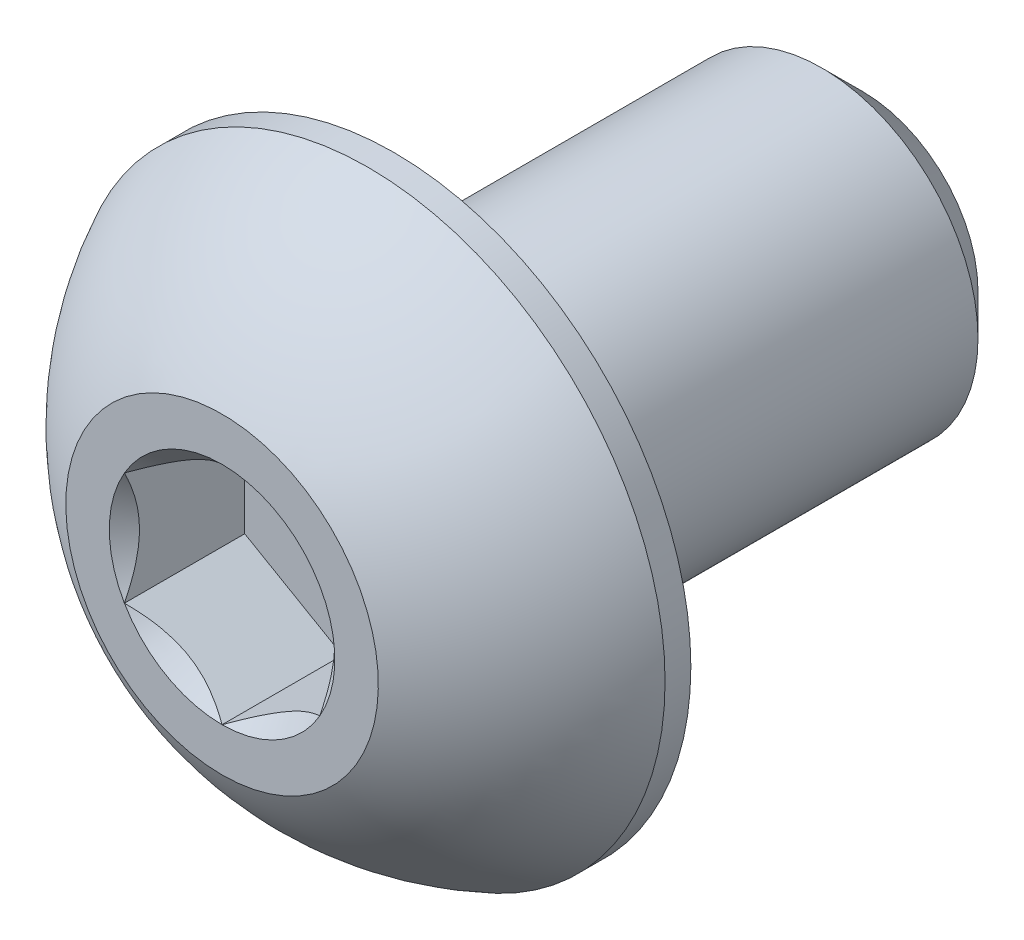
from build123d import *

# Parameters (mm, degrees)
CUT_EXTRUDE2_DEPTH = 1.54


with BuildPart() as part:
    # Sketch10 → Revolve3 (revolve)
    with BuildSketch(Plane(origin=(0, 0, 0), x_dir=(0, 0, -1), z_dir=(1, 0, 0))):
        Polygon((7.675, 2), (8.2, 1.475), (8.2, 0), (2.2, 0), (2.2, 2), align=None)
    revolve(axis=Axis((0, 0, 0), (0, 0, -1)))

    # Sketch7 → Revolve2 (revolve)
    with BuildSketch(Plane(origin=(0, 0, 0), x_dir=(0, 0, -1), z_dir=(1, 0, 0))):
        with BuildLine():
            Line((1.87, 3.8), (2.2, 3.8))
            Line((2.2, 3.8), (2.2, 0))
            Line((2.2, 0), (0, 0))
            Line((0, 0), (0, 2))
            ThreePointArc((0, 2), (0.793500147, 3.047002626), (1.87, 3.8))
        make_face()
    revolve(axis=Axis((0, 0, 0), (0, 0, -1)))

    # Sketch5 → Cut-Extrude2 (cut)
    with BuildSketch(Plane.XY):
        Polygon((1.25, -0.721687836), (1.25, 0.721687836), (0, 1.443375673), (-1.25, 0.721687836), (-1.25, -0.721687836), (0, -1.443375673), align=None)
    extrude(amount=-CUT_EXTRUDE2_DEPTH, mode=Mode.SUBTRACT)

    # Cut-Extrude3 cone 1 section (through the dimple's axis) → Cut-Extrude3 (revolve, cut)
    with BuildSketch(Plane(origin=(0, 0, 0), x_dir=(0, -1, 0), z_dir=(1, 0, 0))):
        Polygon((0, 0), (1.443375673, 0), (0, 1.443375673), align=None)
    revolve(axis=Axis((0, 0, 0), (0, 0, -1)), mode=Mode.SUBTRACT)


solid = part.part
